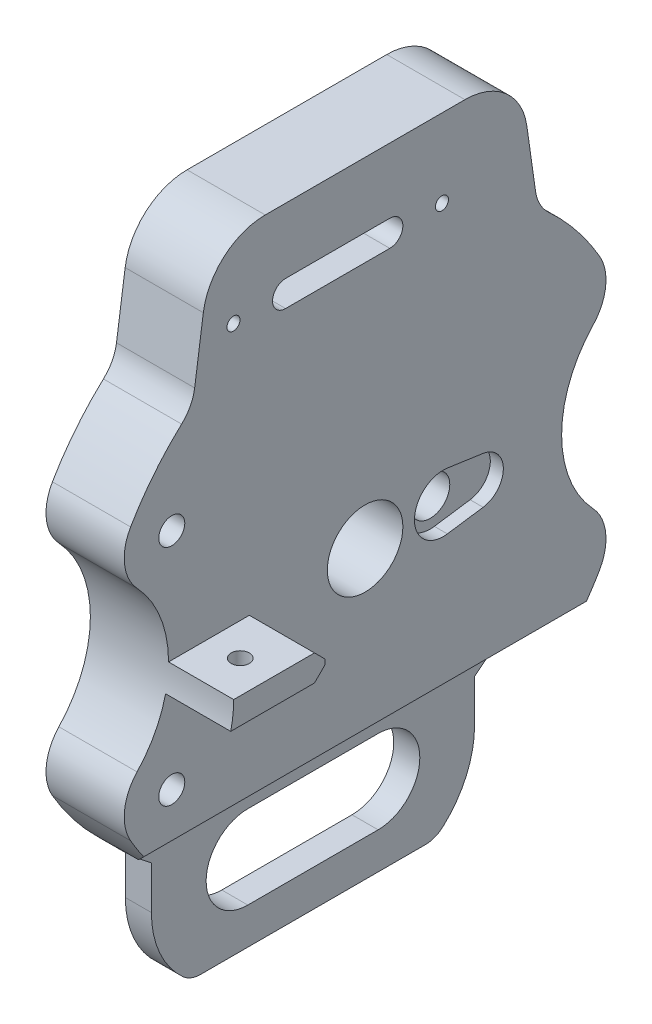
from build123d import *

# Parameters (mm, degrees)
SZKIC1_R                       = 14.5
SZKIC1_R_2                     = 5
DODANIE_WYCI_GNI_CIE1_DEPTH    = 15
M6_TAPPED_HOLE1_D              = 5
DODANIE_WYCI_GNI_CIE3_START    = -25
DODANIE_WYCI_GNI_CIE3_DEPTH    = 25
OTW_R_GWINTOWANY_M8X1_01_D     = 7
OTW_R_GWINTOWANY_M8X1_01_DEPTH = 18.896987833
OTW_R_GWINTOWANY_M8X1_01_TIP   = 2.103012167
WYTNIJ_WYCI_GNI_CIE2_DEPTH     = 10
WYTNIJ_WYCI_GNI_CIE4_DEPTH     = 20
SFAZOWANIE4_SIZE               = 10
WYTNIJ_WYCI_GNI_CIE5_DEPTH     = 5
SZKIC17_5_R                    = 7.5
WYTNIJ_WYCI_GNI_CIE6_DEPTH     = 163.311542951


with BuildPart() as part:
    # Szkic1 → Dodanie-wyciągnięcie1 (new, symmetric)
    with BuildSketch(Plane(origin=(0, 0, 0), x_dir=(0, 0, -1), z_dir=(1, 0, 0))):
        with BuildLine():
            Line((62.076569761, 109.385977671), (65.40069858, 86.060032436))
            ThreePointArc((65.40069858, 86.060032436), (67.080888035, 80.867469231), (70.408575711, 76.541704099))
            ThreePointArc((70.408575711, 76.541704099), (81.115709466, 65.086416999), (89.978943384, 52.151603499))
            ThreePointArc((89.978943384, 52.151603499), (92.32041193, 40.919666146), (87.495806927, 30.50995538))
            ThreePointArc((87.495806927, 30.50995538), (75.419960244, 0), (87.495806927, -30.50995538))
            ThreePointArc((87.495806927, -30.50995538), (92.32041193, -40.919666146), (89.978943384, -52.151603499))
            ThreePointArc((89.978943384, -52.151603499), (77.589025222, -69.25274843), (62, -83.498502981))
            Line((62, -83.498502981), (62, -100))
            ThreePointArc((62, -100), (58.828108774, -114.988630917), (49.856267202, -127.407407407))
            ThreePointArc((49.856267202, -127.407407407), (46.738768646, -129.329364235), (43.138357147, -130))
            Line((43.138357147, -130), (25, -130))
            Line((25, -130), (-25, -130))
            Line((-25, -130), (-43.138357147, -130))
            ThreePointArc((-43.138357147, -130), (-46.738768646, -129.329364235), (-49.856267202, -127.407407407))
            ThreePointArc((-49.856267202, -127.407407407), (-58.828108774, -114.988630917), (-62, -100))
            Line((-62, -100), (-62, -83.498502981))
            ThreePointArc((-62, -83.498502981), (-77.589025222, -69.25274843), (-89.978943384, -52.151603499))
            ThreePointArc((-89.978943384, -52.151603499), (-92.32041193, -40.919666146), (-87.495806927, -30.50995538))
            ThreePointArc((-87.495806927, -30.50995538), (-75.419960244, 0), (-87.495806927, 30.50995538))
            ThreePointArc((-87.495806927, 30.50995538), (-92.32041193, 40.919666146), (-89.978943384, 52.151603499))
            ThreePointArc((-89.978943384, 52.151603499), (-81.115709466, 65.086416999), (-70.408575711, 76.541704099))
            ThreePointArc((-70.408575711, 76.541704099), (-67.080888035, 80.867469231), (-65.40069858, 86.060032436))
            Line((-65.40069858, 86.060032436), (-62.076569761, 109.385977671))
            ThreePointArc((-62.076569761, 109.385977671), (-54.044566654, 124.12820267), (-38.316621209, 130))
            Line((-38.316621209, 130), (38.316621209, 130))
            ThreePointArc((38.316621209, 130), (54.044566654, 124.12820267), (62.076569761, 109.385977671))
        make_face()
        Circle(SZKIC1_R, mode=Mode.SUBTRACT)
        with Locations((-74.189369185, 43)):
            Circle(SZKIC1_R_2, mode=Mode.SUBTRACT)
        with Locations((-74.189369185, -43)):
            Circle(SZKIC1_R_2, mode=Mode.SUBTRACT)
        with BuildLine():
            Line((-25, -84), (25, -84))
            ThreePointArc((25, -84), (41, -100), (25, -116))
            Line((25, -116), (-25, -116))
            ThreePointArc((-25, -116), (-41, -100), (-25, -84))
        make_face(mode=Mode.SUBTRACT)
    extrude(amount=DODANIE_WYCI_GNI_CIE1_DEPTH, both=True)

    # M6 Tapped Hole1 (through all)
    with Locations(Plane(origin=(15, 0, 0), x_dir=(0, 0, -1), z_dir=(1, 0, 0))):
        with Locations((-50.510423527, 100), (29.489576473, 100)):
            Hole(M6_TAPPED_HOLE1_D / 2)

    # Szkic5 → Dodanie-wyciągnięcie3 (add)
    with BuildSketch(Plane.ZY.offset(-15).offset(DODANIE_WYCI_GNI_CIE3_START)):
        with BuildLine():
            Line((75.419960244, 0), (44.419960244, 0))
            Line((44.419960244, 0), (40.419960244, -4))
            Line((40.419960244, -4), (40.419960244, -6))
            Line((40.419960244, -6), (44.419960244, -10))
            Line((44.419960244, -10), (76.556013712, -10))
            ThreePointArc((76.556013712, -10), (75.704884126, -5.032161998), (75.419960244, 0))
        make_face()
    extrude(amount=DODANIE_WYCI_GNI_CIE3_DEPTH)

    # Otwór gwintowany M8x1.01
    with Locations(Plane(origin=(0, 0, 0), x_dir=(1, 0, 0), z_dir=(0, 1, 0))):
        with Locations((27.5, -60.419960244)):
            Hole(OTW_R_GWINTOWANY_M8X1_01_D / 2, depth=OTW_R_GWINTOWANY_M8X1_01_DEPTH)
            with Locations((0, 0, -(OTW_R_GWINTOWANY_M8X1_01_DEPTH + OTW_R_GWINTOWANY_M8X1_01_TIP / 2))):  # 118° drill point
                Cone(0, OTW_R_GWINTOWANY_M8X1_01_D / 2, OTW_R_GWINTOWANY_M8X1_01_TIP, mode=Mode.SUBTRACT)

    # Szkic12 → Wytnij-wyciągnięcie2 (cut)
    with BuildSketch(Plane(origin=(15, 0, 0), x_dir=(0, 0, -1), z_dir=(1, 0, 0))):
        with BuildLine():
            Line((9.489576473, 105), (-30.510423527, 105))
            ThreePointArc((-30.510423527, 105), (-35.510423527, 100), (-30.510423527, 95))
            Line((-30.510423527, 95), (9.489576473, 95))
            ThreePointArc((9.489576473, 95), (14.489576473, 100), (9.489576473, 105))
        make_face()
    extrude(amount=-WYTNIJ_WYCI_GNI_CIE2_DEPTH, mode=Mode.SUBTRACT)

    # Szkic16 → Wytnij-wyciągnięcie4 (cut)
    with BuildSketch(Plane(origin=(15, 0, 0), x_dir=(0, 0, -1), z_dir=(1, 0, 0))):
        with BuildLine():
            Line((-43.138357147, -130), (43.138357147, -130))
            ThreePointArc((43.138357147, -130), (46.738768646, -129.329364235), (49.856267202, -127.407407407))
            ThreePointArc((49.856267202, -127.407407407), (58.828108774, -114.988630917), (62, -100))
            Line((62, -100), (62, -83.498502981))
            ThreePointArc((62, -83.498502981), (69.784912958, -77.110738056), (76.915538092, -70))
            Line((76.915538092, -70), (-76.915538092, -70))
            ThreePointArc((-76.915538092, -70), (-69.784912958, -77.110738056), (-62, -83.498502981))
            Line((-62, -83.498502981), (-62, -100))
            ThreePointArc((-62, -100), (-58.828108774, -114.988630917), (-49.856267202, -127.407407407))
            ThreePointArc((-49.856267202, -127.407407407), (-46.738768646, -129.329364235), (-43.138357147, -130))
        make_face()
        with BuildLine():
            Line((-25, -116), (25, -116))
            ThreePointArc((25, -116), (41, -100), (25, -84))
            Line((25, -84), (-25, -84))
            ThreePointArc((-25, -84), (-41, -100), (-25, -116))
        make_face(mode=Mode.SUBTRACT)
    extrude(amount=-WYTNIJ_WYCI_GNI_CIE4_DEPTH, mode=Mode.SUBTRACT)

    # Sfazowanie4
    sfazowanie4_edges = [part.edges().sort_by_distance(p)[0] for p in [
        (15, -70, 0),
    ]]
    chamfer(sfazowanie4_edges, length=SFAZOWANIE4_SIZE)

    # Szkic17 → Wytnij-wyciągnięcie5 (cut)
    with BuildSketch(Plane(origin=(15, 0, 0), x_dir=(0, 0, -1), z_dir=(1, 0, 0))):
        with BuildLine():
            Line((31.578571429, -10.936663671), (45.292857143, -8.957177034))
            ThreePointArc((45.292857143, -8.957177034), (53.05, 0), (45.292857142, 8.957177033))
            Line((45.292857142, 8.957177033), (31.578571428, 10.93666367))
            ThreePointArc((31.578571428, 10.93666367), (22.462605729, 8.080234378), (18.98012619, -0.815402484))
            ThreePointArc((18.98012619, -0.815402484), (23.079412621, -8.614404816), (31.578571429, -10.936663671))
        make_face()
    extrude(amount=-WYTNIJ_WYCI_GNI_CIE5_DEPTH, mode=Mode.SUBTRACT)

    # Szkic17<5> → Wytnij-wyciągnięcie6 (cut, through all)
    with BuildSketch(Plane(origin=(15, 0, 0), x_dir=(0, 0, -1), z_dir=(1, 0, 0))):
        with Locations((30, -1e-09)):
            Circle(SZKIC17_5_R)
    extrude(amount=-WYTNIJ_WYCI_GNI_CIE6_DEPTH, mode=Mode.SUBTRACT)


solid = part.part
